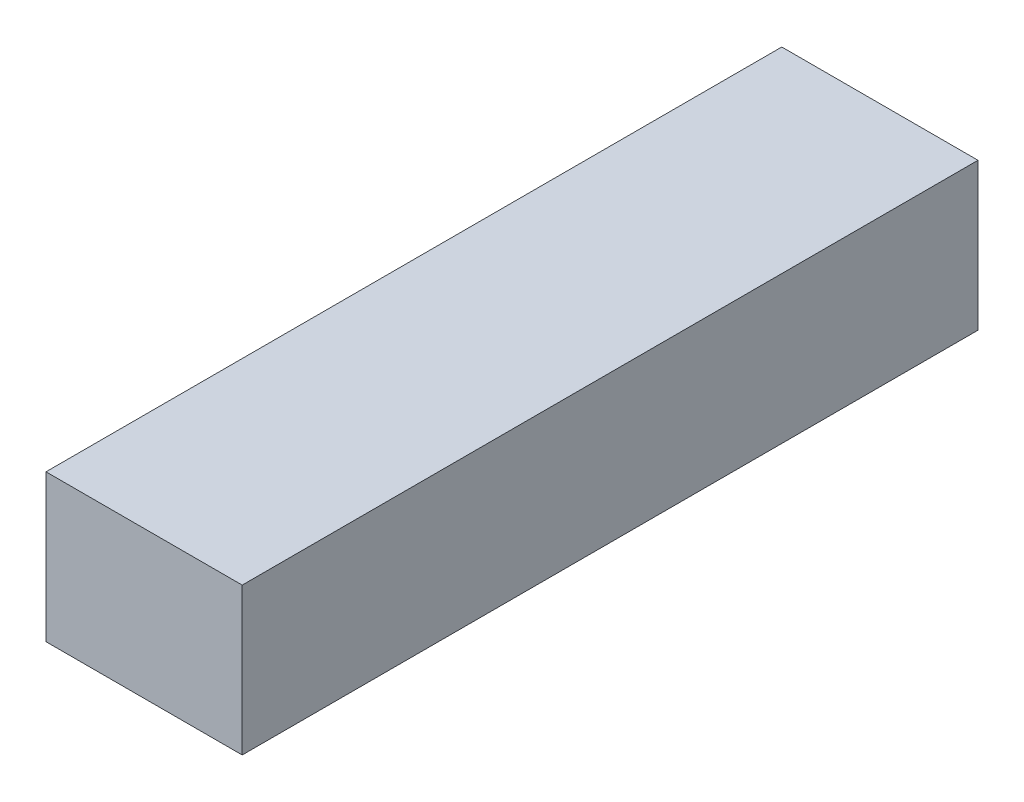
from build123d import *

# Parameters (mm, degrees)
SKETCH1_W           = 8
SKETCH1_H           = 6
BOSS_EXTRUDE1_DEPTH = 30


with BuildPart() as part:
    # Sketch1 → Boss-Extrude1 (new body)
    with BuildSketch(Plane.XY):
        with Locations((-4, 3)):
            Rectangle(SKETCH1_W, SKETCH1_H)
    extrude(amount=BOSS_EXTRUDE1_DEPTH)


solid = part.part
